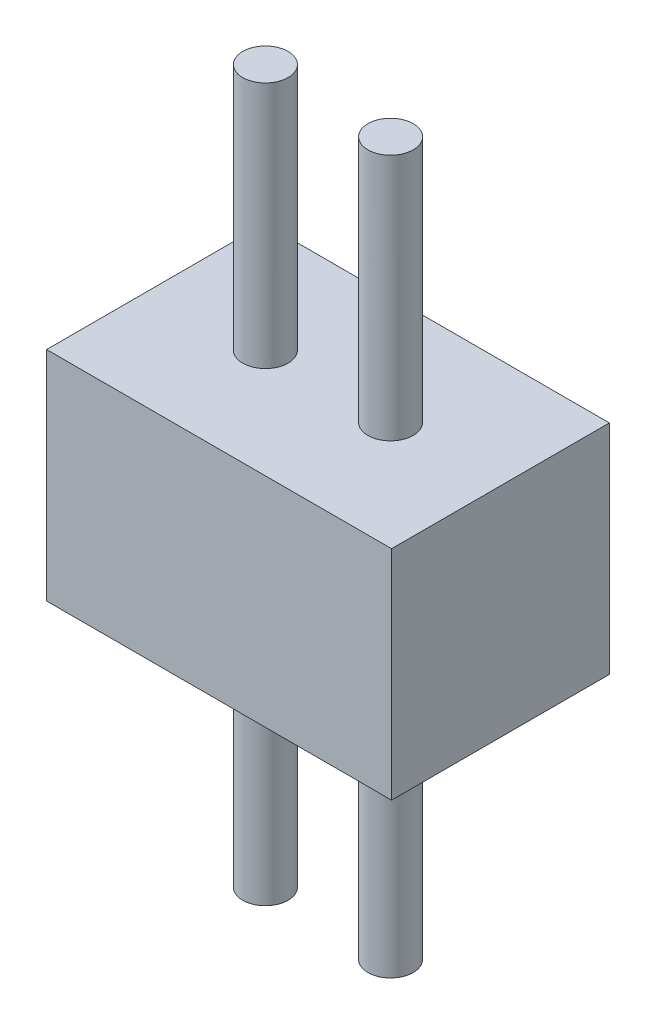
from build123d import *

# Parameters (mm, degrees)
SKETCH1_W           = 3.5
SKETCH1_H           = 2.21
BOSS_EXTRUDE1_DEPTH = 2.21
SKETCH2_R           = 0.23
BOSS_EXTRUDE2_DEPTH = 2.51
BOSS_EXTRUDE3_START = 2.51
SKETCH3_R           = 0.23
BOSS_EXTRUDE3_DEPTH = 2.51


with BuildPart() as part:
    # Sketch1 → Boss-Extrude1 (new body)
    with BuildSketch(Plane(origin=(0, 0, 0), x_dir=(1, 0, 0), z_dir=(0, 1, 0))):
        with Locations((1.75, 1.105)):
            Rectangle(SKETCH1_W, SKETCH1_H)
    extrude(amount=BOSS_EXTRUDE1_DEPTH)

    # Sketch2 → Boss-Extrude2 (add)
    with BuildSketch(Plane.XZ):
        with Locations(Location((1.115, -1.105, 0), (0, 0, 270))):
            Circle(SKETCH2_R)
        with Locations(Location((2.385, -1.105, 0), (0, 0, 270))):
            Circle(SKETCH2_R)
    extrude(amount=BOSS_EXTRUDE2_DEPTH)

    # Sketch3 → Boss-Extrude3 (add)
    with BuildSketch(Plane(origin=(0, 2.21, 0), x_dir=(1, 0, 0), z_dir=(0, 1, 0)).offset(BOSS_EXTRUDE3_START)):
        with Locations(Location((2.385, 1.105, 0), (0, 0, 90))):
            Circle(SKETCH3_R)
        with Locations(Location((1.115, 1.105, 0), (0, 0, 90))):
            Circle(SKETCH3_R)
    extrude(amount=-BOSS_EXTRUDE3_DEPTH)


solid = part.part
